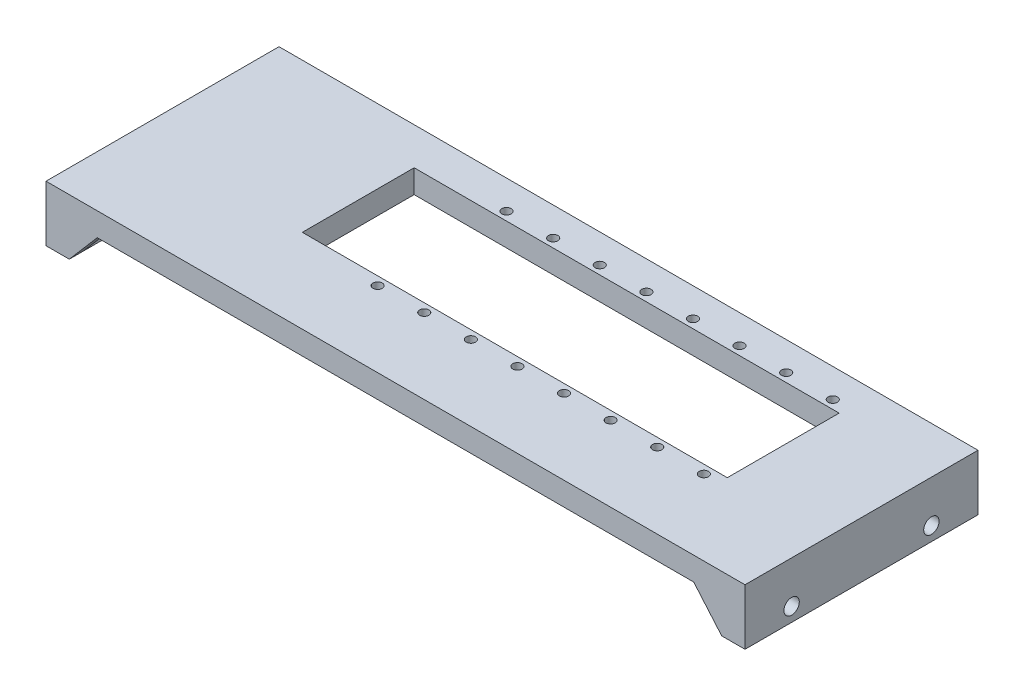
from build123d import *

# Parameters (mm, degrees)
EXTRUDE_2_DEPTH                 = 40
CUT_EXTRUDE_1_DEPTH             = 151.894002532
CUT_EXTRUDE_1_DEPTH_BACK        = 151.894002532
SKETCH_3_R                      = 1.65
EXTRUDE_3_DEPTH                 = 3
MIRROR_2_COPY_1_DEPTH           = 3
CUT_EXTRUDE_2_DEPTH             = 5
SKETCH_10_R                     = 1
CUT_EXTRUDE_3_DEPTH             = 5
EXTRUDE_4_DEPTH                 = 10
CUT_EXTRUDE_4_REACH             = 87.843
CUT_EXTRUDE_4_DIRECTION_2_DEPTH = 7
CUT_EXTRUDE_5_DEPTH             = 91.93404203
CUT_EXTRUDE_5_DEPTH_BACK        = 91.93404203
SKETCH_12_R                     = 1.65


with BuildPart() as part:
    # 草图1 → 凸台-拉伸2 (new body)
    with BuildSketch(Plane.XY):
        Polygon((-75, 0), (75, 0), (75, -12), (70, -12), (70, -5), (-70, -5), (-70, -12), (-75, -12), align=None)
    extrude(amount=EXTRUDE_2_DEPTH)

    # 草图3 → 切除-拉伸1 (cut, two sides: drawn at the far end of the back side and taken through both)
    with BuildSketch(Plane(origin=(-70, 0, 0), x_dir=(0, 0, -1), z_dir=(1, 0, 0)).offset(-CUT_EXTRUDE_1_DEPTH_BACK)):
        with Locations(Location((-10, -9, 0), (0, 0, 90))):
            Circle(SKETCH_3_R)
    extrude(amount=CUT_EXTRUDE_1_DEPTH + CUT_EXTRUDE_1_DEPTH_BACK, mode=Mode.SUBTRACT)

    # 草图4 → 凸台-拉伸3 (add)
    with BuildSketch(Plane(origin=(0, 0, 0), x_dir=(-1, 0, 0), z_dir=(0, 0, -1))):
        Polygon((64, -5), (70, -12), (70, -5), align=None)
    extrude_3 = extrude(amount=-EXTRUDE_3_DEPTH)

    # 镜向1: 凸台-拉伸3 across plane
    add(extrude_3.mirror(Plane.XY.offset(20)))

    # 镜向2: 凸台-拉伸3 across plane
    add(extrude_3.mirror(Plane(origin=(0, 0, 0), x_dir=(0, 0, 1), z_dir=(1, 0, 0))))

    # 镜向2 copy 1 sketch → 镜向2 copy 1 (add)
    with BuildSketch(Plane.XY.offset(40)):
        Polygon((64, -5), (70, -12), (70, -5), align=None)
    extrude(amount=-MIRROR_2_COPY_1_DEPTH)

    # 草图7 → 切除-拉伸2 (cut)
    with BuildSketch(Plane.XZ.offset(5)):
        Polygon((53.2, 22.4), (53.2, 17.6), (53.2, 8), (34, 8), (-37.996196674, 8), (-37.996196674, 32), (34, 32), (53.2, 32), align=None)
    extrude(amount=-CUT_EXTRUDE_2_DEPTH, mode=Mode.SUBTRACT)

    # 草图10 → 切除-拉伸3 (cut)
    with BuildSketch(Plane.XZ.offset(5)):
        with Locations(Location((50, 33.835, 0), (0, 0, 270))):
            Circle(SKETCH_10_R)
        with Locations(Location((40, 33.835, 0), (0, 0, 270))):
            Circle(SKETCH_10_R)
        with Locations(Location((30, 33.835, 0), (0, 0, 270))):
            Circle(SKETCH_10_R)
        with Locations(Location((20, 33.835, 0), (0, 0, 270))):
            Circle(SKETCH_10_R)
        with Locations(Location((10, 33.835, 0), (0, 0, 270))):
            Circle(SKETCH_10_R)
        with Locations(Location((0, 33.835, 0), (0, 0, 270))):
            Circle(SKETCH_10_R)
        with Locations(Location((-10, 33.835, 0), (0, 0, 270))):
            Circle(SKETCH_10_R)
        with Locations(Location((-20, 33.835, 0), (0, 0, 270))):
            Circle(SKETCH_10_R)
        with Locations(Location((50, 6.165, 0), (0, 0, 90))):
            Circle(SKETCH_10_R)
        with Locations(Location((40, 6.165, 0), (0, 0, 90))):
            Circle(SKETCH_10_R)
        with Locations(Location((30, 6.165, 0), (0, 0, 90))):
            Circle(SKETCH_10_R)
        with Locations(Location((20, 6.165, 0), (0, 0, 90))):
            Circle(SKETCH_10_R)
        with Locations(Location((10, 6.165, 0), (0, 0, 90))):
            Circle(SKETCH_10_R)
        with Locations(Location((0, 6.165, 0), (0, 0, 90))):
            Circle(SKETCH_10_R)
        with Locations(Location((-10, 6.165, 0), (0, 0, 90))):
            Circle(SKETCH_10_R)
        with Locations(Location((-20, 6.165, 0), (0, 0, 90))):
            Circle(SKETCH_10_R)
    extrude(amount=-CUT_EXTRUDE_3_DEPTH, mode=Mode.SUBTRACT)

    # 草图11 → 凸台-拉伸4 (add)
    with BuildSketch(Plane.XY.offset(40)):
        Polygon((-75, -12), (-70, -12), (-64, -5), (64, -5), (70, -12), (75, -12), (75, 0), (-75, 0), align=None)
    extrude(amount=EXTRUDE_4_DEPTH)

    # 草图11<3> → 切除-拉伸4 (cut, up to next)
    with BuildSketch(Plane.XY.offset(40), mode=Mode.PRIVATE) as cut_extrude_4_sk1:
        Polygon((-70, -12), (-70, -5), (-64, -5), align=None)
    cut_extrude_4_tool1 = extrude(cut_extrude_4_sk1.sketch, amount=-CUT_EXTRUDE_4_REACH, mode=Mode.PRIVATE) & part.part
    # 草图11<3> → 切除-拉伸4 (cut, up to next)
    with BuildSketch(Plane.XY.offset(40), mode=Mode.PRIVATE) as cut_extrude_4_sk2:
        Polygon((64, -5), (70, -5), (70, -12), align=None)
    cut_extrude_4_tool2 = extrude(cut_extrude_4_sk2.sketch, amount=-CUT_EXTRUDE_4_REACH, mode=Mode.PRIVATE) & part.part
    add(cut_extrude_4_tool1.solids().sort_by_distance((-68, -7.333333, 40))[0], mode=Mode.SUBTRACT)
    add(cut_extrude_4_tool2.solids().sort_by_distance((68, -7.333333, 40))[0], mode=Mode.SUBTRACT)

    # 草图11<3> → 切除-拉伸4 direction 2 (cut)
    with BuildSketch(Plane.XY.offset(40)):
        Polygon((-70, -12), (-70, -5), (-64, -5), align=None)
        Polygon((64, -5), (70, -5), (70, -12), align=None)
    extrude(amount=CUT_EXTRUDE_4_DIRECTION_2_DEPTH, mode=Mode.SUBTRACT)

    # 草图12 → 切除-拉伸5 (cut, two sides: drawn at the far end of the back side and taken through both)
    with BuildSketch(Plane(origin=(0, 0, 0), x_dir=(0, 0, -1), z_dir=(1, 0, 0)).offset(-CUT_EXTRUDE_5_DEPTH_BACK)):
        with Locations((-40, -9)):
            Circle(SKETCH_12_R)
    extrude(amount=CUT_EXTRUDE_5_DEPTH + CUT_EXTRUDE_5_DEPTH_BACK, mode=Mode.SUBTRACT)


solid = part.part
